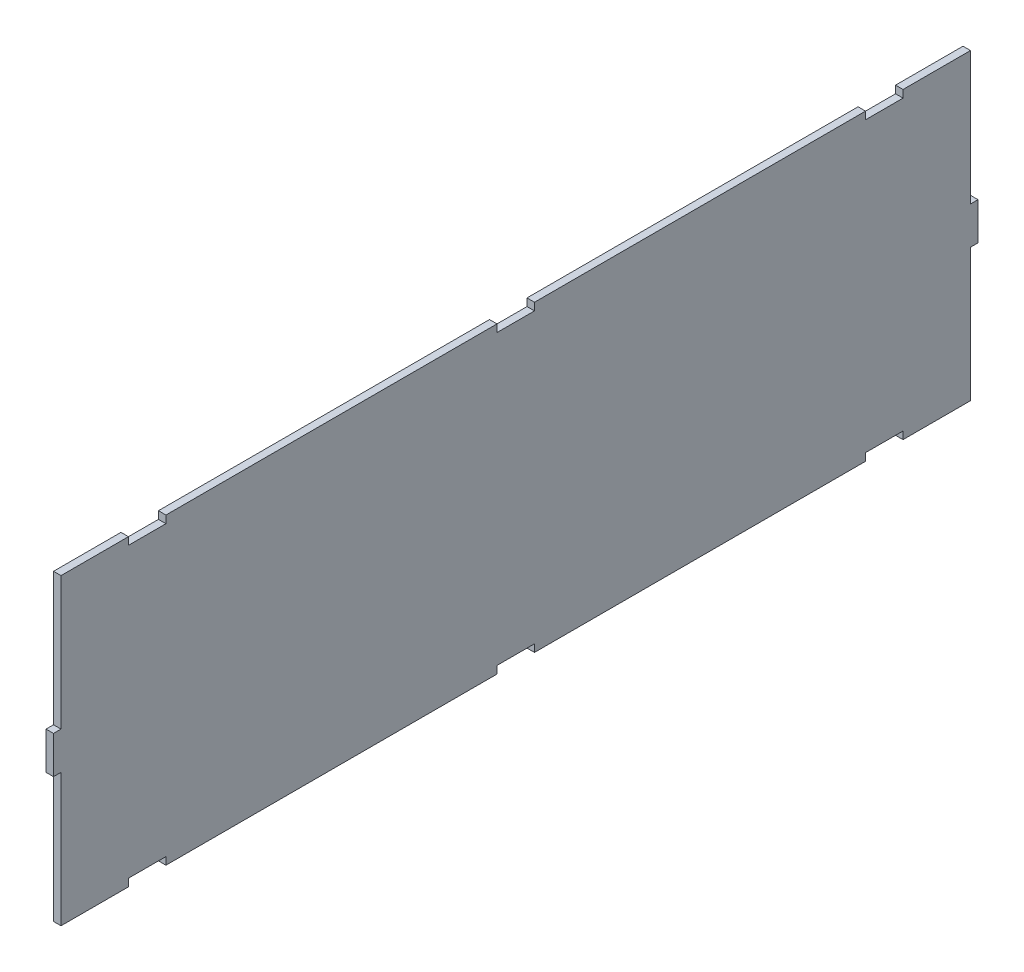
from build123d import *

# Parameters (mm, degrees)
BOSS_EXTRUDE1_DEPTH = 3


with BuildPart() as part:
    # Sketch1 → Boss-Extrude1 (new body)
    with BuildSketch(Plane(origin=(0, 0, 0), x_dir=(0, 0, -1), z_dir=(1, 0, 0))):
        Polygon((177.5, -3), (192.5, -3), (192.5, 0), (325, 0), (325, -3), (340, -3), (340, 0), (367, 0), (367, -53.19), (370, -53.19), (370, -68.19), (367, -68.19), (367, -121.38), (340, -121.38), (340, -118.38), (325, -118.38), (325, -121.38), (192.5, -121.38), (192.5, -118.38), (177.5, -118.38), (177.5, -121.38), (45, -121.38), (45, -118.38), (30, -118.38), (30, -121.38), (3, -121.38), (3, -68.19), (0, -68.19), (0, -53.19), (3, -53.19), (3, 0), (30, 0), (30, -3), (45, -3), (45, 0), (177.5, 0), align=None)
    extrude(amount=BOSS_EXTRUDE1_DEPTH)


solid = part.part
